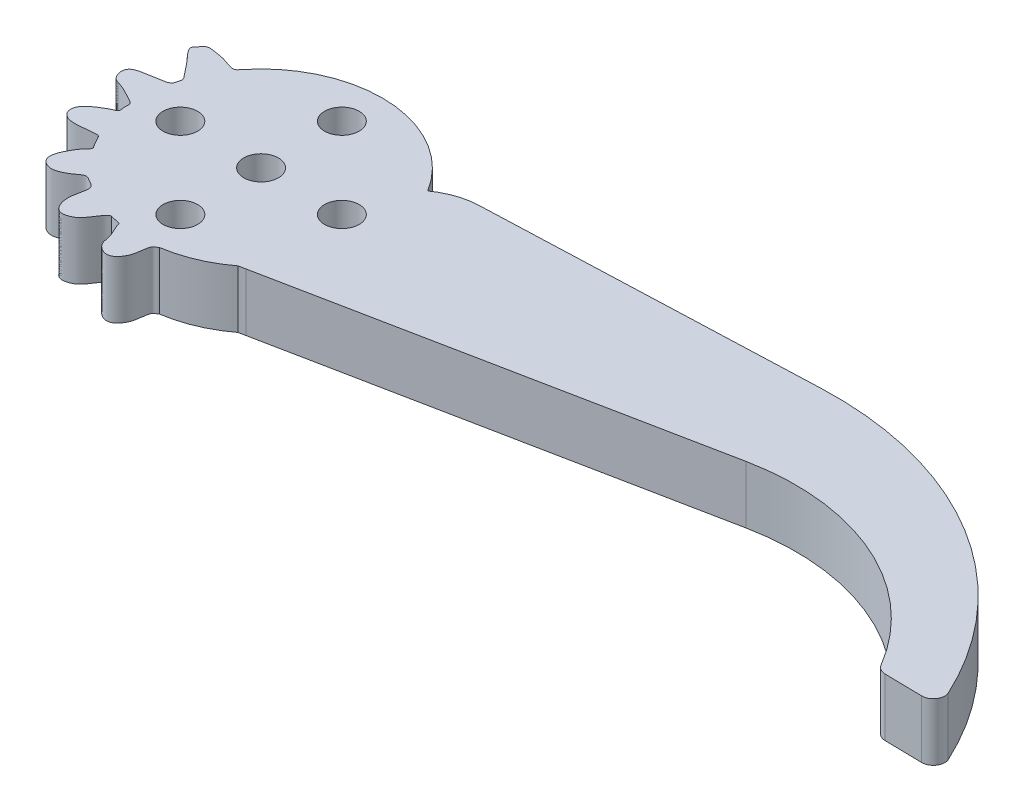
from build123d import *

# Parameters (mm, degrees)
EXTRUDE_1_DEPTH     = 5
SKETCH_3_R          = 1.5
CUT_EXTRUDE_1_DEPTH = 10


with BuildPart() as part:
    # 草图1 → 凸台-拉伸1 (new body)
    with BuildSketch(Plane(origin=(0, 0, 0), x_dir=(1, 0, 0), z_dir=(0, 1, 0))):
        with BuildLine():
            Line((-21.065147109, -6.903355583), (15.059085589, 0.323029299))
            ThreePointArc((15.059085589, 0.323029299), (27.136805009, -1.026369993), (36.203600032, -9.118675775))
            ThreePointArc((36.203600032, -9.118675775), (36.561182887, -9.474191429), (37.046780667, -9.610028366))
            Line((37.046780667, -9.610028366), (40.270419299, -9.667704625))
            ThreePointArc((40.270419299, -9.667704625), (41.094345923, -9.259728671), (41.236929209, -8.351450372))
            ThreePointArc((41.236929209, -8.351450372), (29.680040733, 4.654782059), (12.847740294, 9.059031737))
            Line((12.847740294, 9.059031737), (-15.739118956, 7.963865935))
            ThreePointArc((-15.739118956, 7.963865935), (-17.47041044, 7.638761691), (-19.032672596, 6.824882138))
            ThreePointArc((-19.032672596, 6.824882138), (-27.379744713, 11.82302598), (-36.247811423, 7.821470332))
            Line((-36.247811423, 7.821470332), (-36.376333727, 7.668869417))
            add(Edge.make_bspline(
                [(-36.376333727, 7.668869417), (-36.387747467, 7.659039445), (-36.409053452, 7.641104857), (-36.438782924, 7.618756885), (-36.468697201, 7.60022642), (-36.500577476, 7.585227496), (-36.53633659, 7.573510447), (-36.577181175, 7.565178291), (-36.62458693, 7.560450811), (-36.679418695, 7.559859107), (-36.739277778, 7.563890333), (-36.801369861, 7.572251686), (-36.864076005, 7.584218065), (-36.930225464, 7.60003312), (-37.002345065, 7.620281999), (-37.079044913, 7.644519996), (-37.159563084, 7.672157054), (-37.248458441, 7.704325388), (-37.338255569, 7.737820557), (-37.427045448, 7.770754248), (-37.506995254, 7.799679146), (-37.585548453, 7.826888277), (-37.662314595, 7.851882621), (-37.73714169, 7.87436555), (-37.810116198, 7.894242834), (-37.881563059, 7.911622616), (-37.953883871, 7.927211775), (-38.025932154, 7.940996801), (-38.09890006, 7.953805001), (-38.172462622, 7.96611404), (-38.248388008, 7.978594052), (-38.326938256, 7.991566399), (-38.407178581, 8.005033559), (-38.489645681, 8.019141173), (-38.573760053, 8.033748853), (-38.658919567, 8.048612502), (-38.744134267, 8.063321399), (-38.827913338, 8.077257248), (-38.908559849, 8.089741098), (-38.984838099, 8.100217608), (-39.055944217, 8.108237394), (-39.121375397, 8.113436223), (-39.180929397, 8.115534841), (-39.234706556, 8.114339672), (-39.291173541, 8.108972808), (-39.354595763, 8.095747862), (-39.421223133, 8.068980067), (-39.486990485, 8.026644209), (-39.540301655, 7.981025015), (-39.584029126, 7.939322747), (-39.616560038, 7.906953772), (-39.651029048, 7.871730153), (-39.687700406, 7.833655879), (-39.725485709, 7.794072221), (-39.763595683, 7.753945027), (-39.800119309, 7.715331193), (-39.834053429, 7.679254745), (-39.864617608, 7.646484144), (-39.89217446, 7.616552044), (-39.916903001, 7.589146169), (-39.938677106, 7.564263969), (-39.958205644, 7.540912284), (-39.975660975, 7.518575082), (-39.991203081, 7.496673849), (-40.004851896, 7.475005848), (-40.016846931, 7.453177218), (-40.027436658, 7.430682334), (-40.037435306, 7.405254142), (-40.045904105, 7.377166688), (-40.051774187, 7.346647221), (-40.054372428, 7.316011233), (-40.053816969, 7.285636914), (-40.05066397, 7.255718981), (-40.045398946, 7.226473261), (-40.038026718, 7.197123764), (-40.027721142, 7.165162127), (-40.013572966, 7.13006233), (-39.994095559, 7.090251724), (-39.969715862, 7.047075977), (-39.939730348, 6.999345249), (-39.903857672, 6.946612093), (-39.861999565, 6.888682652), (-39.814240835, 6.82561666), (-39.760849365, 6.757727441), (-39.702276118, 6.68558191), (-39.63915513, 6.610000574), (-39.572303516, 6.532057528), (-39.502721468, 6.453080461), (-39.431592252, 6.37465065), (-39.360282213, 6.298602964), (-39.290340772, 6.227025863), (-39.245780542, 6.183849552), (-39.224336539, 6.163829443)],
                knots=[0, 0, 0, 0, 0.01376463, 0.02752926, 0.041008189, 0.054677586, 0.068156515, 0.081635444, 0.095114373, 0.108702141, 0.12218107, 0.133657454, 0.144208851, 0.154760249, 0.165311647, 0.176332423, 0.186883821, 0.197435219, 0.210597566, 0.220722288, 0.23084701, 0.240971731, 0.251096453, 0.261221174, 0.271345896, 0.281470617, 0.291595339, 0.302512261, 0.312593979, 0.322677656, 0.333086612, 0.34316833, 0.353250048, 0.363331766, 0.373413484, 0.383495202, 0.393667986, 0.403890021, 0.414112056, 0.424334092, 0.434556127, 0.444778162, 0.455000197, 0.465222233, 0.475444268, 0.49078118, 0.510910556, 0.531039932, 0.551169308, 0.560175733, 0.569091042, 0.578124233, 0.587300808, 0.596623043, 0.605504362, 0.614474291, 0.622865281, 0.630850185, 0.638835089, 0.646819993, 0.654804896, 0.6627898, 0.671572546, 0.680657343, 0.689605383, 0.698553422, 0.707501462, 0.716449502, 0.727821716, 0.738723964, 0.749626212, 0.760768305, 0.771313698, 0.781859092, 0.792404485, 0.802949878, 0.815695114, 0.827982107, 0.840269099, 0.852556091, 0.864843084, 0.877130076, 0.889417069, 0.901704061, 0.913991053, 0.926278046, 0.938565038, 0.95085203, 0.963139023, 0.975426015, 0.987713008, 1, 1, 1, 1], degree=3, weights=[1, 1, 1, 1, 1, 1, 1, 1, 1, 1, 1, 1, 1, 1, 1, 1, 1, 1, 1, 1, 1, 1, 1, 1, 1, 1, 1, 1, 1, 1, 1, 1, 1, 1, 1, 1, 1, 1, 1, 1, 1, 1, 1, 1, 1, 1, 1, 1, 1, 1, 1, 1, 1, 1, 1, 1, 1, 1, 1, 1, 1, 1, 1, 1, 1, 1, 1, 1, 1, 1, 1, 1, 1, 1, 1, 1, 1, 1, 1, 1, 1, 1, 1, 1, 1, 1, 1, 1, 1, 1, 1, 1, 1]))
            Line((-39.224336539, 6.163829443), (-38.093102376, 4.752004548))
            add(Edge.make_bspline(
                [(-38.005568342, 4.482198854), (-38.02125938, 4.626615076), (-38.093102376, 4.752004548)],
                knots=[2.757297324, 2.757297324, 2.757297324, 3.156188718, 3.156188718, 3.156188718], degree=2, weights=[1, 0.98017655, 1]))
            ThreePointArc((-38.005568342, 4.482198854), (-38.092110225, 4.191572262), (-38.170223652, 3.898567815))
            add(Edge.make_bspline(
                [(-38.170223652, 3.898567815), (-38.17899833, 3.89045042), (-38.203942224, 3.867563628), (-38.24223912, 3.833835764), (-38.285589015, 3.799213081), (-38.328887945, 3.769178178), (-38.37409655, 3.742826479), (-38.422877853, 3.719349576), (-38.476597257, 3.698035234), (-38.536322549, 3.678267388), (-38.602823895, 3.659526144), (-38.676573851, 3.641387775), (-38.757747323, 3.623524748), (-38.846221734, 3.6057056), (-38.941630809, 3.587785214), (-39.048962999, 3.568711422), (-39.171173058, 3.548039939), (-39.307794576, 3.525930736), (-39.450562363, 3.503596992), (-39.593432459, 3.481726299), (-39.718084941, 3.462797612), (-39.822846984, 3.446774709), (-39.908727353, 3.43344701), (-39.989506962, 3.420615372), (-40.065159976, 3.408200409), (-40.13564115, 3.39613813), (-40.201216452, 3.384328673), (-40.265125122, 3.372127822), (-40.327060851, 3.359488911), (-40.387487255, 3.346282969), (-40.445873805, 3.332671414), (-40.502770651, 3.318535134), (-40.559338578, 3.303544259), (-40.617719517, 3.287007569), (-40.681276374, 3.267541668), (-40.748770693, 3.24461445), (-40.816217481, 3.218575253), (-40.880436101, 3.189944537), (-40.944601336, 3.156396743), (-41.007390042, 3.116823805), (-41.06738907, 3.070042844), (-41.120682608, 3.018100217), (-41.166077181, 2.961889357), (-41.203490093, 2.901970604), (-41.23420749, 2.836820485), (-41.262005249, 2.7540052), (-41.281552559, 2.65253237), (-41.2883081, 2.534673296), (-41.281430882, 2.416423516), (-41.260926392, 2.292033603), (-41.225140665, 2.164093508), (-41.170397797, 2.031073325), (-41.097183611, 1.902839496), (-41.00409085, 1.785316591), (-40.893992281, 1.687807784), (-40.769547935, 1.616518233), (-40.678313916, 1.589775637), (-40.631011904, 1.582429038)],
                knots=[0, 0, 0, 0, 0.007377472, 0.021665987, 0.035954502, 0.050243017, 0.064531532, 0.078820047, 0.093108562, 0.107397077, 0.121685592, 0.135974107, 0.150262622, 0.164551138, 0.178839653, 0.193152655, 0.209869047, 0.227750703, 0.245632359, 0.263514014, 0.281396484, 0.293513864, 0.305492603, 0.317471343, 0.329450083, 0.341428823, 0.353407563, 0.365386303, 0.378928544, 0.392060906, 0.404708032, 0.417763129, 0.430244451, 0.442725772, 0.457007248, 0.473170123, 0.489234792, 0.505299461, 0.521599443, 0.540785136, 0.559801155, 0.578817173, 0.597588849, 0.615342741, 0.633096634, 0.652435749, 0.68070726, 0.70814558, 0.735415054, 0.762003635, 0.793532706, 0.824826653, 0.859021338, 0.894298956, 0.929532637, 0.964766319, 1, 1, 1, 1], degree=3, weights=[1, 1, 1, 1, 1, 1, 1, 1, 1, 1, 1, 1, 1, 1, 1, 1, 1, 1, 1, 1, 1, 1, 1, 1, 1, 1, 1, 1, 1, 1, 1, 1, 1, 1, 1, 1, 1, 1, 1, 1, 1, 1, 1, 1, 1, 1, 1, 1, 1, 1, 1, 1, 1, 1, 1, 1, 1, 1]))
            add(Edge.make_bspline(
                [(-40.631011904, 1.582429038), (-40.589836111, 1.56975957), (-40.474050138, 1.532690959), (-40.298342288, 1.470196946), (-40.111432357, 1.39563054), (-39.943433147, 1.321915991), (-39.791803496, 1.250087374), (-39.654252099, 1.180990627), (-39.528737509, 1.115283546), (-39.413468135, 1.053435789), (-39.306902245, 0.995728873), (-39.207747965, 0.942256176), (-39.114963275, 0.892922939), (-39.027756022, 0.847446253), (-38.945583887, 0.805355108), (-38.868154484, 0.765990196), (-38.795424996, 0.72850471), (-38.72680961, 0.691432142), (-38.665867164, 0.655253366), (-38.613463737, 0.619220887), (-38.569742735, 0.583179323), (-38.532357404, 0.54494125), (-38.501161506, 0.503678078), (-38.478436061, 0.462514636), (-38.463512117, 0.423416675), (-38.454659602, 0.387289472), (-38.450131186, 0.351081641), (-38.44931781, 0.313661579), (-38.45158924, 0.274737991), (-38.456046129, 0.233855416), (-38.461304091, 0.192190102), (-38.465853755, 0.150441172), (-38.468832239, 0.108771535), (-38.469997094, 0.065314503), (-38.469091989, 0.018959333), (-38.466015174, -0.030090727), (-38.460898402, -0.081424419), (-38.45410708, -0.13442224), (-38.445940597, -0.190303713), (-38.437324259, -0.247180926), (-38.429727727, -0.302695956), (-38.424427968, -0.353777465), (-38.422014097, -0.400501703), (-38.42302504, -0.44294202), (-38.427882803, -0.480742231), (-38.436859179, -0.513932411), (-38.450130577, -0.542744213), (-38.470195039, -0.570954739), (-38.498172956, -0.596430998), (-38.534605531, -0.619502638), (-38.574924686, -0.639401065), (-38.619126673, -0.658129652), (-38.666583481, -0.676926226), (-38.716834906, -0.696763598), (-38.772397856, -0.719503693), (-38.835872721, -0.746986035), (-38.908111568, -0.780428091), (-38.986358949, -0.819200207), (-39.067872958, -0.862145636), (-39.180050321, -0.924434457), (-39.295362036, -0.992611945), (-39.410372751, -1.062946685), (-39.49499527, -1.115656168), (-39.578871101, -1.168885656), (-39.661692708, -1.222645159), (-39.756926807, -1.286326317), (-39.84766361, -1.350088516), (-39.935331029, -1.416101575), (-40.0062369, -1.472690435), (-40.075984488, -1.531865156), (-40.143255856, -1.592529152), (-40.208416459, -1.65501259), (-40.274784491, -1.722728928), (-40.334598376, -1.788200479), (-40.387084747, -1.849921282), (-40.429685431, -1.903608582), (-40.467476794, -1.955225661), (-40.500350392, -2.004633223), (-40.528402973, -2.051927948), (-40.554889126, -2.103152519), (-40.576252707, -2.153326848), (-40.593645859, -2.203925422), (-40.606703505, -2.250159451), (-40.617555817, -2.297415908), (-40.62643752, -2.345894765), (-40.633873156, -2.399029021), (-40.639238699, -2.457611174), (-40.641140018, -2.520976362), (-40.638515412, -2.584691117), (-40.631005889, -2.647322057), (-40.616607359, -2.717507863), (-40.59220185, -2.795073991), (-40.550980709, -2.885813945), (-40.502078844, -2.962559597), (-40.450033254, -3.025752229), (-40.405940222, -3.071438259), (-40.357430555, -3.11499404), (-40.30923788, -3.152995994), (-40.263159962, -3.185872723), (-40.22078417, -3.213751414), (-40.178141436, -3.23956008), (-40.134935588, -3.263379557), (-40.076053877, -3.292455725), (-40.014101962, -3.317474621), (-39.944822262, -3.338834832), (-39.889294704, -3.352970564), (-39.828949955, -3.365504496), (-39.763745491, -3.376416159), (-39.693951397, -3.385657769), (-39.614581543, -3.393720627), (-39.52949684, -3.399711109), (-39.440523362, -3.403243893), (-39.3549572, -3.404268649), (-39.269672957, -3.402999442), (-39.184844183, -3.399551541), (-39.100658202, -3.394119704), (-39.016998607, -3.386982736), (-38.931979277, -3.378350282), (-38.846591998, -3.368818015), (-38.759692683, -3.358896347), (-38.672152867, -3.349126063), (-38.581710252, -3.339569271), (-38.488464085, -3.330439437), (-38.392868942, -3.32186262), (-38.265603036, -3.311386165), (-38.138298378, -3.301924528), (-38.018967231, -3.292921229), (-37.933818775, -3.286315932), (-37.855744476, -3.280123397), (-37.784056763, -3.274489826), (-37.719116188, -3.269795019), (-37.660998883, -3.2665489), (-37.609496566, -3.265391514), (-37.564116533, -3.26709303), (-37.524081664, -3.272553735), (-37.488330421, -3.282804043), (-37.455516849, -3.299004487), (-37.424010572, -3.322445724), (-37.3918968, -3.354548531), (-37.368616482, -3.382758716), (-37.356094601, -3.398846057)],
                knots=[0, 0, 0, 0, 0.004714179, 0.013662433, 0.022610687, 0.031558941, 0.040507196, 0.04945545, 0.058403704, 0.067351958, 0.076300212, 0.085248467, 0.094196721, 0.103144975, 0.112093229, 0.121041484, 0.129989738, 0.138937992, 0.148200525, 0.156221895, 0.163850873, 0.17147985, 0.179108828, 0.186737805, 0.192792241, 0.198369093, 0.203945944, 0.209522795, 0.215099646, 0.220676497, 0.226253348, 0.231141662, 0.235660415, 0.240179168, 0.244697921, 0.249216674, 0.253735427, 0.25825418, 0.262772933, 0.267806976, 0.27263308, 0.277271378, 0.281909677, 0.286547975, 0.291186273, 0.295824571, 0.300520199, 0.305290361, 0.312089825, 0.318464819, 0.324839812, 0.331214806, 0.3375898, 0.343964793, 0.350339787, 0.357735004, 0.365908258, 0.374081512, 0.382254766, 0.39042802, 0.406729092, 0.414628615, 0.422528137, 0.43042766, 0.438327183, 0.446226706, 0.458082035, 0.465173505, 0.472557212, 0.479648681, 0.486740151, 0.493831621, 0.500923091, 0.509401657, 0.515713137, 0.522024617, 0.528336097, 0.534647577, 0.540959057, 0.547270537, 0.555957371, 0.562513755, 0.569070139, 0.575626523, 0.582182907, 0.588739291, 0.596672647, 0.604934831, 0.613197015, 0.621459198, 0.629755107, 0.641750814, 0.654218085, 0.670111583, 0.678364223, 0.686616862, 0.694869502, 0.70347226, 0.710126535, 0.716723398, 0.723320261, 0.729917124, 0.736513986, 0.749650996, 0.755996952, 0.762342908, 0.768688863, 0.775034819, 0.781380774, 0.78772673, 0.795507815, 0.802345669, 0.809108629, 0.815871588, 0.822634547, 0.829397507, 0.836160466, 0.842923426, 0.850045195, 0.856738464, 0.863484436, 0.870283526, 0.877136152, 0.884042736, 0.891003703, 0.904506202, 0.911628298, 0.918426121, 0.925223944, 0.932021767, 0.938819591, 0.945617414, 0.952415237, 0.95921306, 0.966010884, 0.972808707, 0.97960653, 0.986404353, 0.993202177, 1, 1, 1, 1], degree=3, weights=[1, 1, 1, 1, 1, 1, 1, 1, 1, 1, 1, 1, 1, 1, 1, 1, 1, 1, 1, 1, 1, 1, 1, 1, 1, 1, 1, 1, 1, 1, 1, 1, 1, 1, 1, 1, 1, 1, 1, 1, 1, 1, 1, 1, 1, 1, 1, 1, 1, 1, 1, 1, 1, 1, 1, 1, 1, 1, 1, 1, 1, 1, 1, 1, 1, 1, 1, 1, 1, 1, 1, 1, 1, 1, 1, 1, 1, 1, 1, 1, 1, 1, 1, 1, 1, 1, 1, 1, 1, 1, 1, 1, 1, 1, 1, 1, 1, 1, 1, 1, 1, 1, 1, 1, 1, 1, 1, 1, 1, 1, 1, 1, 1, 1, 1, 1, 1, 1, 1, 1, 1, 1, 1, 1, 1, 1, 1, 1, 1, 1, 1, 1, 1, 1, 1, 1, 1, 1, 1, 1, 1]))
            ThreePointArc((-37.356094601, -3.398846057), (-37.070708664, -3.925213006), (-36.755783246, -4.434456837))
            add(Edge.make_bspline(
                [(-36.755783246, -4.434456837), (-36.757611144, -4.448571603), (-36.7635299, -4.486376637), (-36.776703751, -4.539961947), (-36.797284476, -4.593232023), (-36.82273266, -4.63966895), (-36.852824483, -4.681987603), (-36.887305481, -4.722591587), (-36.925890539, -4.763573246), (-36.968263899, -4.806713656), (-37.014079153, -4.853482629), (-37.062959246, -4.90503871), (-37.114496477, -4.962229183), (-37.168252497, -5.025590059), (-37.223758313, -5.095346099), (-37.280514276, -5.171410753), (-37.337990114, -5.253386376), (-37.396324754, -5.341622085), (-37.454213718, -5.434168946), (-37.51226562, -5.531737857), (-37.566735763, -5.627495049), (-37.616940879, -5.719018495), (-37.661654049, -5.802919104), (-37.702894596, -5.882367522), (-37.741158051, -5.958036772), (-37.77632483, -6.02955268), (-37.808376039, -6.096836896), (-37.837394066, -6.160108176), (-37.867292375, -6.22840233), (-37.89441437, -6.294886908), (-37.919187639, -6.361492685), (-37.939602721, -6.421808386), (-37.958110721, -6.48266394), (-37.974891426, -6.544933577), (-37.990036859, -6.609600064), (-38.003403336, -6.677447814), (-38.01509498, -6.752372941), (-38.023545689, -6.832997015), (-38.026915704, -6.917361219), (-38.024008947, -6.999935383), (-38.014261878, -7.079971334), (-37.996279769, -7.161480611), (-37.967819985, -7.244724685), (-37.926532517, -7.328578624), (-37.87352739, -7.408227678), (-37.81156427, -7.480133185), (-37.742808775, -7.543959373), (-37.669187745, -7.599993404), (-37.589926238, -7.649911798), (-37.503826437, -7.694866294), (-37.421899189, -7.729896793), (-37.346735893, -7.756590554), (-37.28144123, -7.776057535), (-37.216687605, -7.79161089), (-37.152503693, -7.803125292), (-37.088606137, -7.810469464), (-37.024383874, -7.813506706), (-36.958948007, -7.81209126), (-36.891345139, -7.806100213), (-36.820427098, -7.795461642), (-36.745414806, -7.780110284), (-36.665178933, -7.759790799), (-36.578995261, -7.734175225), (-36.486326143, -7.702808087), (-36.389131153, -7.665969778), (-36.288657343, -7.623794182), (-36.186923976, -7.576696944), (-36.083732037, -7.52412587), (-35.980413841, -7.466579229), (-35.877791388, -7.404602408), (-35.776856451, -7.339166717), (-35.678535048, -7.27154876), (-35.581591186, -7.201825181), (-35.492370597, -7.13583657), (-35.411112436, -7.075658951), (-35.339200609, -7.023524795), (-35.271848128, -6.976957572), (-35.208969732, -6.936868741), (-35.150326885, -6.903956238), (-35.095485488, -6.878673816), (-35.04381619, -6.861231268), (-34.993738626, -6.851446112), (-34.944512126, -6.849458605), (-34.894971185, -6.854950652), (-34.844712509, -6.867080169), (-34.792759555, -6.885089829), (-34.738463895, -6.908273464), (-34.681656551, -6.935838989), (-34.622478797, -6.966948321), (-34.556496174, -7.003420632), (-34.487890787, -7.042681942), (-34.418210589, -7.083384937), (-34.353494499, -7.121732839), (-34.290927758, -7.159380496), (-34.231300711, -7.196070223), (-34.174767292, -7.232135216), (-34.118131187, -7.270439061), (-34.063157589, -7.311564159), (-34.01224392, -7.356612844), (-33.969336385, -7.404729432), (-33.934841061, -7.457939623), (-33.908440766, -7.520058775), (-33.893464688, -7.584624344), (-33.886623911, -7.649989867), (-33.884825553, -7.70997014), (-33.886736905, -7.776384098), (-33.892156283, -7.849182454), (-33.900802592, -7.928013432), (-33.91231528, -8.012222616), (-33.926254505, -8.100853558), (-33.942346762, -8.194071984), (-33.959752495, -8.288700221), (-33.977611511, -8.382113917), (-33.9949993, -8.471251466), (-34.011749054, -8.556603865), (-34.027561097, -8.637774418), (-34.042110912, -8.714104773), (-34.055158908, -8.785237679), (-34.066550334, -8.851116597), (-34.076215644, -8.911987261), (-34.084754609, -8.972544368), (-34.091814916, -9.032530918), (-34.097275278, -9.093291563), (-34.100898669, -9.152715016), (-34.102829616, -9.212420382), (-34.103142141, -9.273214934), (-34.101885733, -9.334782199), (-34.099122428, -9.397279979), (-34.094751933, -9.462273554), (-34.087773792, -9.537780831), (-34.076968083, -9.623425232), (-34.061204508, -9.716448624), (-34.041208215, -9.808510394), (-34.015702586, -9.903353589), (-33.98454923, -9.998476703), (-33.947550148, -10.093396772), (-33.906528263, -10.183633553), (-33.845985767, -10.298216275), (-33.776559522, -10.40254985), (-33.697480513, -10.491706372), (-33.633698351, -10.549943487), (-33.56452772, -10.599818497), (-33.481822847, -10.645261678), (-33.384037852, -10.681822108), (-33.270637785, -10.704602167), (-33.162444782, -10.710024741), (-33.063327278, -10.703527797), (-32.975048376, -10.690112368), (-32.887173652, -10.670089148), (-32.776524856, -10.637434777), (-32.674730009, -10.599120115), (-32.584405352, -10.560291394), (-32.5245311, -10.532671651), (-32.466632645, -10.504003245), (-32.410630531, -10.474061944), (-32.356260926, -10.44237174), (-32.303043955, -10.408182796), (-32.252135134, -10.37178939), (-32.202809767, -10.332525595), (-32.154549255, -10.290102569), (-32.10517011, -10.242572735), (-32.054349887, -10.189576146), (-32.002012431, -10.131095686), (-31.94824286, -10.067382398), (-31.89328715, -9.998954863), (-31.837278942, -9.926244841), (-31.777931384, -9.846421247), (-31.717096909, -9.761909976), (-31.656177071, -9.6748587), (-31.598649023, -9.590712421), (-31.544132434, -9.509410263), (-31.493000302, -9.431996231), (-31.445433196, -9.359267763), (-31.401419258, -9.291775725), (-31.360754203, -9.229824411), (-31.323041318, -9.173471548), (-31.287691461, -9.12252829), (-31.253923066, -9.076559221), (-31.220762136, -9.034882355), (-31.187042249, -8.996569135), (-31.151404554, -8.960444435), (-31.112297773, -8.925086557), (-31.0679782, -8.888827233), (-31.016509703, -8.849751624), (-30.955763721, -8.805698323), (-30.907534084, -8.771405674), (-30.881067284, -8.752585979)],
                knots=[0, 0, 0, 0, 0.002778228, 0.007861976, 0.012945725, 0.018029473, 0.023113222, 0.028196971, 0.033280719, 0.038364468, 0.043448216, 0.048531965, 0.053615713, 0.058699462, 0.06378321, 0.068866959, 0.073950707, 0.079034456, 0.084303419, 0.089387168, 0.094817362, 0.099600599, 0.104161177, 0.108721755, 0.113282333, 0.117842911, 0.122403489, 0.126964067, 0.131524645, 0.138036713, 0.143058829, 0.148080946, 0.153103063, 0.15812518, 0.163225992, 0.168491347, 0.173926551, 0.180389955, 0.186853358, 0.193316761, 0.199780165, 0.206244027, 0.213841, 0.221741651, 0.229642301, 0.237542952, 0.244782145, 0.251868408, 0.258954671, 0.266040934, 0.273651728, 0.278927047, 0.284202366, 0.289477685, 0.294753004, 0.300028322, 0.305303641, 0.310581985, 0.315857295, 0.321061574, 0.326265854, 0.331470134, 0.336731565, 0.34207651, 0.347506296, 0.352711177, 0.357946782, 0.3631467, 0.368346619, 0.373546538, 0.378746457, 0.383946375, 0.389146294, 0.394690995, 0.399336175, 0.403973181, 0.408610188, 0.413247194, 0.417884201, 0.422521208, 0.427158214, 0.431795221, 0.436645022, 0.4414355, 0.446177668, 0.450919835, 0.455662003, 0.46040417, 0.465146338, 0.469888505, 0.475767442, 0.48078959, 0.485811737, 0.490833885, 0.495856032, 0.500878179, 0.506032541, 0.512296872, 0.518561203, 0.524825534, 0.531089865, 0.537354196, 0.544080387, 0.548169154, 0.552257921, 0.556346688, 0.560435455, 0.564524222, 0.568612989, 0.572701755, 0.576790522, 0.581069933, 0.58512479, 0.589103807, 0.593082824, 0.597061841, 0.601040858, 0.605019875, 0.608998893, 0.61297791, 0.616956927, 0.621814855, 0.626642586, 0.631576779, 0.636549825, 0.641562028, 0.646613698, 0.651441428, 0.656269158, 0.661506064, 0.668357977, 0.675168885, 0.681979793, 0.688790701, 0.696571651, 0.703960024, 0.711346141, 0.718732257, 0.733326899, 0.740483474, 0.747640049, 0.754796625, 0.762088065, 0.771803098, 0.781518397, 0.791233696, 0.798300262, 0.805028785, 0.811754005, 0.818479226, 0.830366241, 0.83534275, 0.840319259, 0.845295768, 0.850272277, 0.855248786, 0.860225295, 0.865210149, 0.869689211, 0.874144661, 0.87860011, 0.88305556, 0.88751101, 0.891966459, 0.896421909, 0.900877359, 0.90539873, 0.910600373, 0.915567019, 0.920533665, 0.925500311, 0.930466957, 0.935433603, 0.940400249, 0.945366895, 0.950333541, 0.955300187, 0.960266832, 0.965233478, 0.970200124, 0.97516677, 0.980133416, 0.985100062, 0.990066708, 0.995033354, 1, 1, 1, 1], degree=3, weights=[1, 1, 1, 1, 1, 1, 1, 1, 1, 1, 1, 1, 1, 1, 1, 1, 1, 1, 1, 1, 1, 1, 1, 1, 1, 1, 1, 1, 1, 1, 1, 1, 1, 1, 1, 1, 1, 1, 1, 1, 1, 1, 1, 1, 1, 1, 1, 1, 1, 1, 1, 1, 1, 1, 1, 1, 1, 1, 1, 1, 1, 1, 1, 1, 1, 1, 1, 1, 1, 1, 1, 1, 1, 1, 1, 1, 1, 1, 1, 1, 1, 1, 1, 1, 1, 1, 1, 1, 1, 1, 1, 1, 1, 1, 1, 1, 1, 1, 1, 1, 1, 1, 1, 1, 1, 1, 1, 1, 1, 1, 1, 1, 1, 1, 1, 1, 1, 1, 1, 1, 1, 1, 1, 1, 1, 1, 1, 1, 1, 1, 1, 1, 1, 1, 1, 1, 1, 1, 1, 1, 1, 1, 1, 1, 1, 1, 1, 1, 1, 1, 1, 1, 1, 1, 1, 1, 1, 1, 1, 1, 1, 1, 1, 1, 1, 1, 1, 1, 1, 1, 1, 1, 1, 1, 1, 1, 1, 1, 1, 1, 1, 1, 1, 1, 1, 1, 1]))
            ThreePointArc((-30.881067284, -8.752585979), (-30.418702462, -8.873862767), (-29.951297142, -8.973970486))
            add(Edge.make_bspline(
                [(-29.951297142, -8.973970486), (-29.947361072, -9.001121296), (-29.936597493, -9.058527046), (-29.913371727, -9.149977795), (-29.884317364, -9.245010352), (-29.850898325, -9.340828907), (-29.813775001, -9.437094696), (-29.774301213, -9.531743562), (-29.732828641, -9.625216094), (-29.69039985, -9.716424276), (-29.647830556, -9.805089336), (-29.606082612, -9.890832359), (-29.565632498, -9.97445356), (-29.52712458, -10.056612436), (-29.49273152, -10.134681089), (-29.463214356, -10.208187685), (-29.438224454, -10.27781407), (-29.41618056, -10.347502327), (-29.396400475, -10.419112479), (-29.378658585, -10.492538739), (-29.360689216, -10.576195064), (-29.343564736, -10.664213762), (-29.326111429, -10.754877063), (-29.309014399, -10.838357995), (-29.290271731, -10.919432378), (-29.26894905, -10.997774286), (-29.244030687, -11.073644757), (-29.214563978, -11.14718518), (-29.179793191, -11.21849976), (-29.139461403, -11.287300333), (-29.093435376, -11.353558885), (-29.038391141, -11.42138791), (-28.966100594, -11.49752648), (-28.873727103, -11.578393256), (-28.759922831, -11.659392871), (-28.640440268, -11.726555591), (-28.5180003, -11.778915521), (-28.400012404, -11.815139944), (-28.293541887, -11.834498105), (-28.199847646, -11.840576089), (-28.119296369, -11.837462499), (-28.04028, -11.82575297), (-27.963013732, -11.805508403), (-27.881503548, -11.774685741), (-27.79682086, -11.731699953), (-27.710134772, -11.675540244), (-27.624970352, -11.608264253), (-27.549315201, -11.536615826), (-27.483161735, -11.463637539), (-27.427725229, -11.394756369), (-27.375977317, -11.323170214), (-27.325850928, -11.24673707), (-27.283323731, -11.175728822), (-27.247590364, -11.111939837), (-27.218849427, -11.057906962), (-27.192078941, -11.004752397), (-27.16724994, -10.952278059), (-27.144291668, -10.899975995), (-27.12309168, -10.847027889), (-27.101412166, -10.786489674), (-27.0823903, -10.724594598), (-27.065420649, -10.659412336), (-27.051681574, -10.599288695), (-27.038453032, -10.533843333), (-27.025599271, -10.462909554), (-27.012991239, -10.386633366), (-27.00050659, -10.305473456), (-26.988029686, -10.220201284), (-26.974958373, -10.128438351), (-26.961190449, -10.031553959), (-26.946585994, -9.931825544), (-26.931511272, -9.834871651), (-26.915788338, -9.742224234), (-26.899232468, -9.655177145), (-26.881669482, -9.574854161), (-26.862913587, -9.502066506), (-26.842767374, -9.437312849), (-26.821021822, -9.380779305), (-26.797456297, -9.332339433), (-26.771838548, -9.291554238), (-26.743924713, -9.25767217), (-26.713459315, -9.229629125), (-26.680175264, -9.206048443), (-26.643793856, -9.185240912), (-26.604024773, -9.165204761), (-26.560566083, -9.143625668), (-26.513104241, -9.117876754), (-26.461314087, -9.085018588), (-26.423677262, -9.05620565), (-26.404023271, -9.039478218)],
                knots=[0, 0, 0, 0, 0.013505004, 0.027010008, 0.039991358, 0.053321811, 0.06630316, 0.07928451, 0.092265859, 0.105446696, 0.118428046, 0.131409396, 0.144390745, 0.157372095, 0.170353444, 0.18162398, 0.192111184, 0.202598388, 0.213085591, 0.223572795, 0.234059999, 0.248242639, 0.26011479, 0.271986941, 0.283859093, 0.295731244, 0.307653615, 0.31976932, 0.331885025, 0.344000731, 0.356116436, 0.368232141, 0.382792252, 0.402054381, 0.42131651, 0.443013313, 0.46145124, 0.479739685, 0.498046052, 0.510722731, 0.523389709, 0.536056687, 0.548723666, 0.561459984, 0.577382505, 0.59322776, 0.609073015, 0.626492738, 0.639380266, 0.651769812, 0.664159358, 0.676548903, 0.69007966, 0.699148608, 0.708217555, 0.717286502, 0.72635545, 0.735424397, 0.744493344, 0.753562292, 0.765523598, 0.773304125, 0.781084652, 0.788865179, 0.796645706, 0.804426233, 0.81220676, 0.819987287, 0.827767814, 0.83646359, 0.845106768, 0.853711948, 0.862317128, 0.870922307, 0.879527487, 0.888132666, 0.896737846, 0.905343025, 0.913948205, 0.922553384, 0.931158564, 0.939763743, 0.948368923, 0.956974102, 0.965579282, 0.974184461, 0.982789641, 0.99139482, 1, 1, 1, 1], degree=3, weights=[1, 1, 1, 1, 1, 1, 1, 1, 1, 1, 1, 1, 1, 1, 1, 1, 1, 1, 1, 1, 1, 1, 1, 1, 1, 1, 1, 1, 1, 1, 1, 1, 1, 1, 1, 1, 1, 1, 1, 1, 1, 1, 1, 1, 1, 1, 1, 1, 1, 1, 1, 1, 1, 1, 1, 1, 1, 1, 1, 1, 1, 1, 1, 1, 1, 1, 1, 1, 1, 1, 1, 1, 1, 1, 1, 1, 1, 1, 1, 1, 1, 1, 1, 1, 1, 1, 1, 1, 1, 1]))
            ThreePointArc((-26.404023271, -9.039478218), (-23.889839289, -8.327244172), (-21.6293891, -7.01622801))
            add(Edge.make_bspline(
                [(-21.6293891, -7.01622801), (-21.440123794, -6.971147881), (-21.252786309, -6.933331637), (-21.065147109, -6.903355583)],
                knots=[0, 0, 0, 0, 1, 1, 1, 1], degree=3, weights=[1, 1, 1, 1]))
        make_face()
    extrude(amount=EXTRUDE_1_DEPTH)

    # 草图3 → 切除-拉伸1 (cut)
    with BuildSketch(Plane(origin=(0, 5, 0), x_dir=(1, 0, 0), z_dir=(0, 1, 0))):
        with Locations(Location((-27.986576055, 8.340576089, 0), (0, 0, 270))):
            Circle(SKETCH_3_R)
        with Locations(Location((-20.986576055, 1.340576089, 0), (0, 0, 270))):
            Circle(SKETCH_3_R)
        with Locations(Location((-27.986576055, -5.659423911, 0), (0, 0, 270))):
            Circle(SKETCH_3_R)
        with Locations(Location((-34.986576055, 1.340576089, 0), (0, 0, 270))):
            Circle(SKETCH_3_R)
        with Locations(Location((-27.986576055, 1.340576089, 0), (0, 0, 270))):
            Circle(SKETCH_3_R)
    extrude(amount=-CUT_EXTRUDE_1_DEPTH, mode=Mode.SUBTRACT)


solid = part.part
